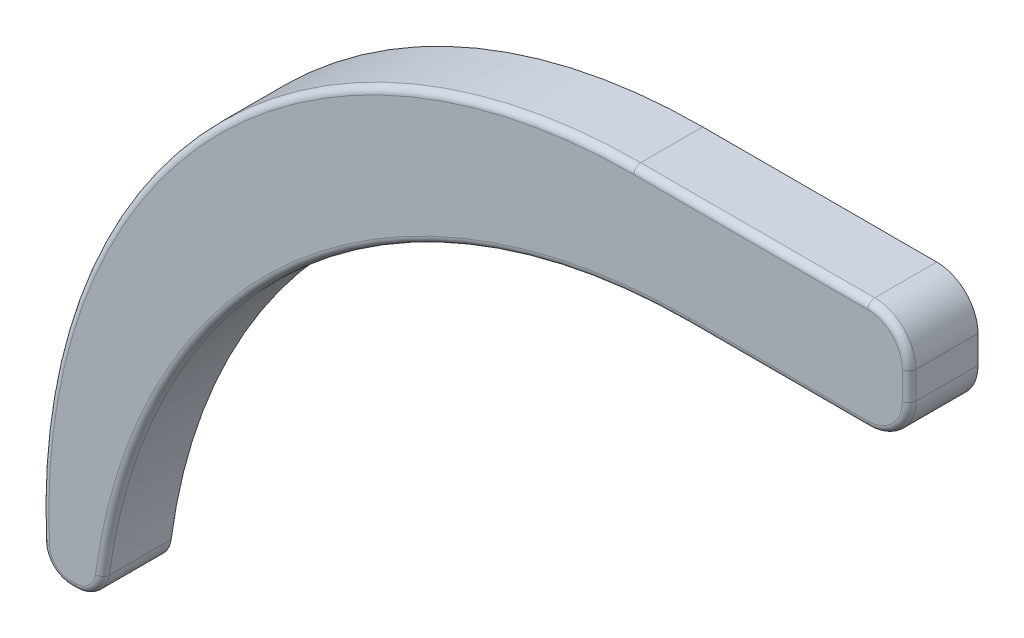
from build123d import *

# Parameters (mm, degrees)
EXTRUDE_1_DEPTH = 5
FILLET_1_R      = 0.5


with BuildPart() as part:
    # Эскиз1 → Бобышка-Вытянуть1 (new body)
    with BuildSketch(Plane.XY):
        with BuildLine():
            Line((0.352984217, 0), (0, 0))
            ThreePointArc((0, 0), (-1.379289319, 0.551704113), (-1.997619047, 1.902439024))
            ThreePointArc((-1.997619047, 1.902439024), (9.812828894, 33.65472035), (40.951190459, 47))
            Line((40.951190459, 47), (57.951190459, 47))
            ThreePointArc((57.951190459, 47), (60.072510802, 46.121320344), (60.951190459, 44))
            Line((60.951190459, 44), (60.951190459, 42))
            ThreePointArc((60.951190459, 42), (60.072510802, 39.878679656), (57.951190459, 39))
            Line((57.951190459, 39), (44.951190459, 39))
            ThreePointArc((44.951190459, 39), (16.645125149, 28.369224066), (2.335126717, 1.733333333))
            ThreePointArc((2.335126717, 1.733333333), (1.669545394, 0.494454695), (0.352984217, 0))
        make_face()
    extrude(amount=EXTRUDE_1_DEPTH)

    # Скругление1
    fillet_1_edges = [part.edges().sort_by_distance(p)[0] for p in [
        (51.451190459, 39, 5),
        (60.072510802, 39.878679656, 5),
        (60.951190459, 43, 5),
        (60.072510802, 46.121320344, 5),
        (49.451190459, 47, 5),
        (9.812828894, 33.65472035, 5),
        (-1.379289319, 0.551704113, 5),
        (0.176492108, 0, 5),
        (1.669545394, 0.494454695, 5),
        (16.645125149, 28.369224066, 5),
    ]]
    fillet(fillet_1_edges, radius=FILLET_1_R)


solid = part.part
